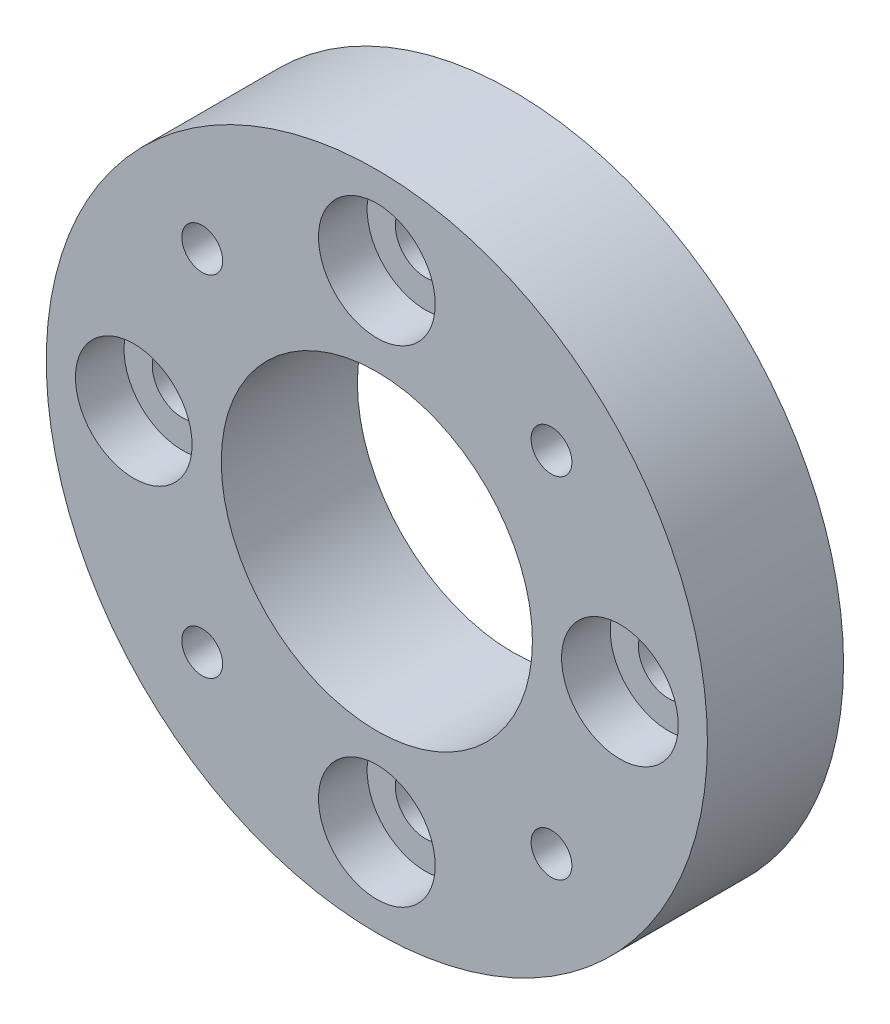
from build123d import *

# Parameters (mm, degrees)
SKETCH1_R           = 17
SKETCH1_R_2         = 1.55
SKETCH1_R_3         = 1.05
SKETCH1_R_4         = 8
BOSS_EXTRUDE1_DEPTH = 7
SKETCH2_R           = 3
CUT_EXTRUDE2_DEPTH  = 2.5


with BuildPart() as part:
    # Sketch1 → Boss-Extrude1 (new body)
    with BuildSketch(Plane.XY):
        Circle(SKETCH1_R)
        with Locations((0, 12.5)):
            Circle(SKETCH1_R_2, mode=Mode.SUBTRACT)
        with Locations((12.5, 0)):
            Circle(SKETCH1_R_2, mode=Mode.SUBTRACT)
        with Locations((0, -12.5)):
            Circle(SKETCH1_R_2, mode=Mode.SUBTRACT)
        with Locations((-12.5, 0)):
            Circle(SKETCH1_R_2, mode=Mode.SUBTRACT)
        with Locations((-8.980256121, 8.980256121)):
            Circle(SKETCH1_R_3, mode=Mode.SUBTRACT)
        with Locations((8.980256121, 8.980256121)):
            Circle(SKETCH1_R_3, mode=Mode.SUBTRACT)
        with Locations((8.980256121, -8.980256121)):
            Circle(SKETCH1_R_3, mode=Mode.SUBTRACT)
        with Locations((-8.980256121, -8.980256121)):
            Circle(SKETCH1_R_3, mode=Mode.SUBTRACT)
        Circle(SKETCH1_R_4, mode=Mode.SUBTRACT)
    extrude(amount=BOSS_EXTRUDE1_DEPTH)

    # Sketch2 → Cut-Extrude2 (cut)
    with BuildSketch(Plane.XY.offset(7)):
        with Locations((0, 12.5)):
            Circle(SKETCH2_R)
        with Locations((12.5, 0)):
            Circle(SKETCH2_R)
        with Locations((0, -12.5)):
            Circle(SKETCH2_R)
        with Locations((-12.5, 0)):
            Circle(SKETCH2_R)
    extrude(amount=-CUT_EXTRUDE2_DEPTH, mode=Mode.SUBTRACT)


solid = part.part
